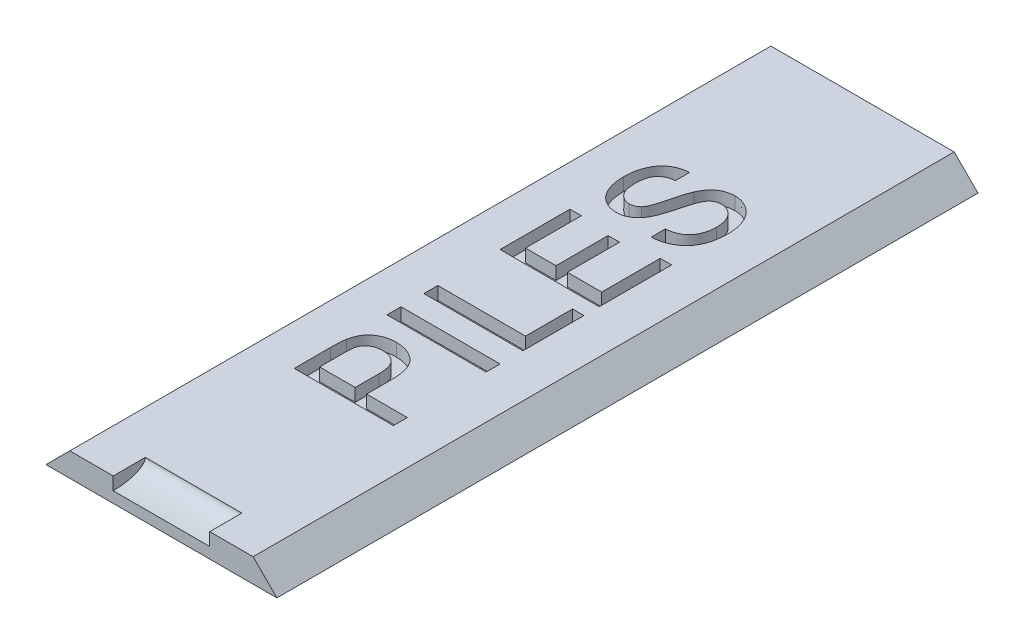
from build123d import *

# Parameters (mm, degrees)
SALIENTE_EXTRUIR1_DEPTH = 54.5
CROQUIS3_RX             = 2.5
CROQUIS3_RY             = 1
CORTAR_EXTRUIR2_DEPTH   = 3.75
CROQUIS4_W              = 7.704956055
CROQUIS4_H              = 1.086596367
CORTAR_EXTRUIR3_DEPTH   = 1


with BuildPart() as part:
    # Croquis1 → Saliente-Extruir1 (new body)
    with BuildSketch(Plane.XY):
        Polygon((0, 0), (1.85, 1.85), (16.1, 1.85), (17.95, 0), align=None)
    extrude(amount=SALIENTE_EXTRUIR1_DEPTH)

    # Croquis3 → Cortar-Extruir2 (cut, symmetric)
    with BuildSketch(Plane(origin=(8.975, 0, 0), x_dir=(0, 0, -1), z_dir=(1, 0, 0))):
        with Locations((-54.5, 1.85)):
            Ellipse(CROQUIS3_RX, CROQUIS3_RY)
    extrude(amount=CORTAR_EXTRUIR2_DEPTH, both=True, mode=Mode.SUBTRACT)

    # Croquis4 → Cortar-Extruir3 (cut)
    # profile 1 of 5: a face of its own
    with BuildSketch(Plane(origin=(0, 1.85, 0), x_dir=(1, 0, 0), z_dir=(0, 1, 0))):
        with BuildLine():
            Line((12.725, -40.224534255), (5.020043945, -40.224534255))
            Line((5.020043945, -40.224534255), (5.020043945, -37.393827243))
            add(Edge.make_bspline(
                [(5.020043945, -37.393827243), (5.020712387, -37.276496719), (5.021967723, -37.056149444), (5.036669327, -36.748437306), (5.054857645, -36.484199896), (5.080753078, -36.324599439), (5.0925866, -36.251666289)],
                knots=[0, 0, 0, 0, 1.22865052, 2.30741144, 3.226532197, 4, 4, 4, 4], degree=3))
            add(Edge.make_bspline(
                [(5.0925866, -36.251666289), (5.109489451, -36.162628237), (5.142281832, -35.989889933), (5.225268231, -35.746863828), (5.3219894, -35.523294036), (5.446633088, -35.323421094), (5.592155323, -35.141713322), (5.766803739, -34.981429606), (5.966372349, -34.839324371), (6.190790323, -34.718498618), (6.432258289, -34.617927706), (6.689506797, -34.547487935), (6.958064607, -34.50237101), (7.141603281, -34.497622162), (7.234910119, -34.495207958)],
                knots=[0, 0, 0, 0, 1.070963964, 2.077723998, 3.031409109, 3.947034396, 4.855896512, 5.777672756, 6.742175787, 7.747333477, 8.787332885, 9.830036646, 10.896840568, 12, 12, 12, 12], degree=3))
            add(Edge.make_bspline(
                [(7.234910119, -34.495207958), (7.314743409, -34.496909349), (7.471819781, -34.500256931), (7.702587646, -34.529002079), (7.924595695, -34.574339399), (8.136324785, -34.641966132), (8.340249896, -34.724641728), (8.532933044, -34.828831715), (8.716985957, -34.950497577), (8.891925848, -35.090080921), (9.054133355, -35.254429358), (9.191947382, -35.452080785), (9.306887372, -35.679773825), (9.403247764, -35.935691127), (9.473527207, -36.222548907), (9.528311414, -36.537980419), (9.557745605, -36.884444343), (9.561856804, -37.125215548), (9.563992388, -37.250285393)],
                knots=[0, 0, 0, 0, 0.928734587, 1.827336177, 2.702165944, 3.561887964, 4.410255795, 5.259404997, 6.106313752, 6.974995773, 7.859929622, 8.783555066, 9.766301868, 10.821656499, 11.958701757, 13.197967894, 14.544469954, 16, 16, 16, 16], degree=3))
            Line((9.563992388, -37.250285393), (9.563992388, -39.137937888))
            Line((9.563992388, -39.137937888), (12.725, -39.137937888))
            Line((12.725, -39.137937888), (12.725, -40.224534255))
        make_face()
        with BuildLine():
            Line((8.674958997, -39.137937888), (8.674958997, -37.279611147))
            add(Edge.make_bspline(
                [(8.674958997, -37.279611147), (8.673714976, -37.205495352), (8.671318486, -37.06271814), (8.654721675, -36.85638616), (8.625668389, -36.667115106), (8.586124634, -36.493820965), (8.533672372, -36.337789043), (8.470964595, -36.197273099), (8.394976718, -36.074374947), (8.307324667, -35.96782338), (8.2090751, -35.876394358), (8.101936262, -35.797094557), (7.98538109, -35.730237373), (7.859182702, -35.676670171), (7.724736421, -35.632399143), (7.579489126, -35.604411928), (7.42579403, -35.58503254), (7.319865427, -35.582895484), (7.265779334, -35.581804324)],
                knots=[0, 0, 0, 0, 1.40421292, 2.705086056, 3.918275699, 5.029558377, 6.068365212, 7.032404237, 7.938575147, 8.797260087, 9.638618655, 10.474993364, 11.317706051, 12.177828306, 13.068718597, 13.993981992, 14.975747128, 16, 16, 16, 16], degree=3))
            add(Edge.make_bspline(
                [(7.265779334, -35.581804324), (7.187347541, -35.584109042), (7.03537411, -35.588574781), (6.816644569, -35.633468235), (6.614700907, -35.704063543), (6.432947694, -35.804195859), (6.275287411, -35.928032887), (6.142785833, -36.069250895), (6.041195642, -36.231560269), (5.998542115, -36.350528828), (5.976989609, -36.410642746)],
                knots=[0, 0, 0, 0, 1.143451971, 2.215610693, 3.244091205, 4.255765529, 5.229231363, 6.159234871, 7.069875225, 8, 8, 8, 8], degree=3))
            add(Edge.make_bspline(
                [(5.976989609, -36.410642746), (5.971593024, -36.432712676), (5.959865872, -36.480672151), (5.946555379, -36.560116645), (5.933951524, -36.652188629), (5.925589453, -36.757336906), (5.917284852, -36.874602552), (5.913456638, -37.004344061), (5.910150152, -37.146856981), (5.909445867, -37.24616686), (5.909077336, -37.298132676)],
                knots=[0, 0, 0, 0, 0.611063981, 1.327884044, 2.165719042, 3.110592661, 4.16481496, 5.328235826, 6.601947678, 8, 8, 8, 8], degree=3))
            Line((5.909077336, -37.298132676), (5.909077336, -39.137937888))
            Line((5.909077336, -39.137937888), (8.674958997, -39.137937888))
        make_face(mode=Mode.SUBTRACT)
    # profile 2 of 5: a face of its own
    with BuildSketch(Plane(origin=(0, 1.85, 0), x_dir=(1, 0, 0), z_dir=(0, 1, 0))):
        with Locations((8.872521973, -32.470187456)):
            Rectangle(CROQUIS4_W, CROQUIS4_H)
    # profile 3 of 5: a face of its own
    with BuildSketch(Plane(origin=(0, 1.85, 0), x_dir=(1, 0, 0), z_dir=(0, 1, 0))):
        Polygon((12.725, -30.148822491), (5.020043945, -30.148822491), (5.020043945, -29.062226124), (11.835966609, -29.062226124), (11.835966609, -25.407311073), (12.725, -25.407311073), align=None)
    # profile 4 of 5: a face of its own
    with BuildSketch(Plane(origin=(0, 1.85, 0), x_dir=(1, 0, 0), z_dir=(0, 1, 0))):
        Polygon((12.725, -24.221933218), (5.020043945, -24.221933218), (5.020043945, -18.788951385), (5.909077336, -18.788951385), (5.909077336, -23.135336851), (8.279833045, -23.135336851), (8.279833045, -19.085295848), (9.168866436, -19.085295848), (9.168866436, -23.135336851), (11.835966609, -23.135336851), (11.835966609, -18.591388409), (12.725, -18.591388409), align=None)
    # profile 5 of 5: a face of its own
    with BuildSketch(Plane(origin=(0, 1.85, 0), x_dir=(1, 0, 0), z_dir=(0, 1, 0))):
        with BuildLine():
            Line((10.057899827, -17.504792042), (10.057899827, -16.418195676))
            add(Edge.make_bspline(
                [(10.057899827, -16.418195676), (10.155466767, -16.406253839), (10.342898111, -16.383312928), (10.608465693, -16.318980185), (10.847115135, -16.236954579), (11.061472654, -16.132559802), (11.251492642, -15.998691026), (11.421841056, -15.834743338), (11.570021369, -15.637253124), (11.698760939, -15.412189393), (11.804702418, -15.164410803), (11.880451865, -14.897911952), (11.925967577, -14.616484744), (11.931780119, -14.423701284), (11.934748097, -14.325262901)],
                knots=[0, 0, 0, 0, 1.125663117, 2.162459464, 3.124651064, 4.013251417, 4.885106576, 5.777454667, 6.711412587, 7.70453926, 8.742726144, 9.79152362, 10.8723159, 12, 12, 12, 12], degree=3))
            add(Edge.make_bspline(
                [(11.934748097, -14.325262901), (11.933083661, -14.238172755), (11.929838332, -14.068363834), (11.892781316, -13.822373021), (11.836622078, -13.591714909), (11.756348797, -13.378942554), (11.657423953, -13.186798246), (11.540433264, -13.018329017), (11.405965658, -12.875927844), (11.253152828, -12.763905309), (11.092873272, -12.675990244), (10.928161901, -12.61147425), (10.759884602, -12.573048001), (10.646660538, -12.568151144), (10.590393785, -12.565717648)],
                knots=[0, 0, 0, 0, 1.267273291, 2.470937522, 3.613914644, 4.718809661, 5.774390768, 6.753382426, 7.696630629, 8.61218657, 9.50073524, 10.352250004, 11.181149856, 12, 12, 12, 12], degree=3))
            add(Edge.make_bspline(
                [(10.590393785, -12.565717648), (10.534687876, -12.568297899), (10.425810757, -12.573340996), (10.266983172, -12.60686922), (10.121062563, -12.669070491), (9.983288138, -12.751340457), (9.857348766, -12.864422046), (9.74329635, -13.009120295), (9.637917046, -13.185172991), (9.580453502, -13.317135911), (9.550101241, -13.386838766)],
                knots=[0, 0, 0, 0, 0.941839432, 1.840823827, 2.725902505, 3.611878027, 4.542122039, 5.568946669, 6.71591688, 8, 8, 8, 8], degree=3))
            add(Edge.make_bspline(
                [(9.550101241, -13.386838766), (9.5389621, -13.413983765), (9.513796756, -13.47530925), (9.480476181, -13.580416511), (9.437422186, -13.705148661), (9.39293408, -13.852451598), (9.346525839, -14.021904032), (9.290873714, -14.212041372), (9.235144294, -14.424538213), (9.174721257, -14.652011958), (9.113861129, -14.881859202), (9.051951432, -15.101002506), (8.992326362, -15.303562802), (8.931970019, -15.489310847), (8.872044918, -15.658562948), (8.813346452, -15.811388271), (8.757275403, -15.948040835), (8.716041031, -16.031501425), (8.696567447, -16.070917007)],
                knots=[0, 0, 0, 0, 0.499206867, 1.127798999, 1.875456396, 2.745236412, 3.745989836, 4.865816661, 6.11691742, 7.484780673, 8.871821359, 10.163659874, 11.360539719, 12.465442435, 13.487424717, 14.416003165, 15.251932479, 16, 16, 16, 16], degree=3))
            add(Edge.make_bspline(
                [(8.696567447, -16.070917007), (8.647548272, -16.1615737), (8.552928507, -16.336564709), (8.384026728, -16.572820324), (8.194749424, -16.770236729), (7.988951227, -16.931452623), (7.768511381, -17.056762282), (7.533463165, -17.142412785), (7.287090189, -17.200195456), (7.117429254, -17.205666227), (7.0311733, -17.208447579)],
                knots=[0, 0, 0, 0, 1.158648043, 2.236492264, 3.255730763, 4.224764102, 5.168065908, 6.094744354, 7.03136427, 8, 8, 8, 8], degree=3))
            add(Edge.make_bspline(
                [(7.0311733, -17.208447579), (6.935653873, -17.204775668), (6.745666425, -17.197472264), (6.466831019, -17.132841849), (6.198259505, -17.029208274), (5.984481011, -16.912324345), (5.82307989, -16.798039314), (5.708463653, -16.702039317), (5.60124325, -16.596122111), (5.501374424, -16.481223492), (5.410177843, -16.356112202), (5.324030469, -16.223744488), (5.249978172, -16.079370256), (5.155728903, -15.876499642), (5.061611366, -15.605108854), (4.979600206, -15.263461267), (4.931305459, -14.903888546), (4.924657476, -14.658795308), (4.921262457, -14.533630102)],
                knots=[0, 0, 0, 0, 1.19987574, 2.38654414, 3.578474407, 4.812047981, 5.438556365, 6.063157668, 6.689933248, 7.332048586, 7.975173567, 8.635638291, 9.315743449, 10.013439258, 11.447896523, 12.918278233, 14.426213869, 16, 16, 16, 16], degree=3))
            add(Edge.make_bspline(
                [(4.921262457, -14.533630102), (4.924347305, -14.396614889), (4.930354098, -14.129819869), (4.981943035, -13.742503285), (5.066587308, -13.380409742), (5.165222652, -13.097295055), (5.263579373, -12.887111418), (5.342821577, -12.738956004), (5.432132479, -12.60096616), (5.526695955, -12.470509832), (5.632668866, -12.352241331), (5.744492627, -12.241306484), (5.864266278, -12.139459095), (6.035764086, -12.018799259), (6.263364726, -11.888487334), (6.558463046, -11.776840777), (6.869463055, -11.699268974), (7.084221677, -11.684288561), (7.193236679, -11.676684257)],
                knots=[0, 0, 0, 0, 1.607284738, 3.12969308, 4.575034728, 5.965153243, 6.637705521, 7.296846459, 7.934914134, 8.565222986, 9.185417795, 9.795898322, 10.412763716, 11.027557596, 12.254905276, 13.478103208, 14.719843788, 16, 16, 16, 16], degree=3))
            Line((7.193236679, -11.676684257), (7.193236679, -12.763280624))
            add(Edge.make_bspline(
                [(7.193236679, -12.763280624), (7.138064783, -12.770185282), (7.030109735, -12.783695652), (6.873821894, -12.817202069), (6.72869359, -12.864211777), (6.593257611, -12.919139225), (6.468947695, -12.98640729), (6.353560223, -13.063156352), (6.250608444, -13.153511126), (6.156345578, -13.252883643), (6.074285814, -13.3650639), (6.003224078, -13.489419056), (5.942527059, -13.625737046), (5.895723995, -13.775269719), (5.856860958, -13.936037713), (5.828963267, -14.109884809), (5.814511774, -14.296204947), (5.81172591, -14.424536852), (5.810295848, -14.490413201)],
                knots=[0, 0, 0, 0, 1.074143617, 2.101780708, 3.08272149, 4.018756036, 4.921684117, 5.809545323, 6.690533959, 7.562671613, 8.451478506, 9.368903006, 10.325822098, 11.328733099, 12.392103336, 13.519840867, 14.726865076, 16, 16, 16, 16], degree=3))
            add(Edge.make_bspline(
                [(5.810295848, -14.490413201), (5.810805779, -14.558889318), (5.811792879, -14.69144224), (5.830088679, -14.883026735), (5.854790021, -15.060729755), (5.892573782, -15.22352156), (5.937579534, -15.373151456), (5.996642006, -15.507246934), (6.064507996, -15.627974619), (6.143666556, -15.733093014), (6.230582437, -15.824236326), (6.322394433, -15.903386301), (6.417302962, -15.971861059), (6.518216437, -16.026385083), (6.622352467, -16.07024701), (6.731651444, -16.098625045), (6.844193619, -16.118694025), (6.920979707, -16.120784273), (6.960174106, -16.121851212)],
                knots=[0, 0, 0, 0, 1.463767833, 2.83349453, 4.11258735, 5.297695043, 6.404355811, 7.448943226, 8.424740201, 9.359993028, 10.255029373, 11.113120303, 11.949635862, 12.752249867, 13.561398762, 14.359474769, 15.162616536, 16, 16, 16, 16], degree=3))
            add(Edge.make_bspline(
                [(6.960174106, -16.121851212), (7.026464161, -16.119043191), (7.155127046, -16.113593082), (7.337918221, -16.057939496), (7.504544221, -15.972343892), (7.595204576, -15.888018583), (7.640840296, -15.845571738)],
                knots=[0, 0, 0, 0, 1.050964922, 2.039826012, 3.013306874, 4, 4, 4, 4], degree=3))
            add(Edge.make_bspline(
                [(7.640840296, -15.845571738), (7.663646844, -15.818813699), (7.714082119, -15.759639949), (7.780827302, -15.649538065), (7.848264787, -15.513028052), (7.915302942, -15.349197802), (7.982755179, -15.158329063), (8.052207121, -14.940730279), (8.121179007, -14.695570126), (8.187673786, -14.430330526), (8.254323711, -14.162343268), (8.321106588, -13.907779197), (8.383170352, -13.673532462), (8.447842879, -13.461892637), (8.504557763, -13.269359478), (8.564443118, -13.099753636), (8.618787739, -12.950027085), (8.657146834, -12.85833554), (8.674958997, -12.815758289)],
                knots=[0, 0, 0, 0, 0.523895241, 1.15856198, 1.91379747, 2.794786646, 3.797548623, 4.933673981, 6.202125154, 7.596592219, 9.013381566, 10.322253347, 11.523322902, 12.62839848, 13.623936171, 14.517279059, 15.31149399, 16, 16, 16, 16], degree=3))
            add(Edge.make_bspline(
                [(8.674958997, -12.815758289), (8.70048893, -12.760350788), (8.750599912, -12.651595149), (8.836371155, -12.497682673), (8.924799262, -12.353226972), (9.021559355, -12.222615033), (9.119958568, -12.100616482), (9.225448936, -11.991447404), (9.334641802, -11.891389628), (9.451646214, -11.805386569), (9.571517617, -11.728131634), (9.695987822, -11.660536912), (9.825774012, -11.606108839), (9.959315635, -11.558372625), (10.098097012, -11.524036455), (10.240716642, -11.497110012), (10.387844802, -11.48140426), (10.487459889, -11.479888853), (10.53791612, -11.479121282)],
                knots=[0, 0, 0, 0, 1.198939608, 2.35331753, 3.461943082, 4.526118786, 5.546665844, 6.541063461, 7.507917594, 8.45466906, 9.391808034, 10.310478591, 11.234866782, 12.156150758, 13.095742909, 14.042062018, 15.008281039, 16, 16, 16, 16], degree=3))
            add(Edge.make_bspline(
                [(10.53791612, -11.479121282), (10.638596849, -11.483205914), (10.838984219, -11.491335661), (11.133916171, -11.559275544), (11.419115014, -11.668287416), (11.645375206, -11.794458088), (11.818453118, -11.914200319), (11.942863909, -12.014756596), (12.057897838, -12.126276557), (12.16716288, -12.246004315), (12.268426735, -12.374872704), (12.361731648, -12.513965595), (12.448019806, -12.661822111), (12.553284802, -12.872928165), (12.662598052, -13.153646574), (12.757411927, -13.510126704), (12.813593698, -13.887186582), (12.820337953, -14.145515819), (12.823781488, -14.277415618)],
                knots=[0, 0, 0, 0, 1.196987384, 2.382393894, 3.582009067, 4.820735309, 5.454243406, 6.085350439, 6.72189866, 7.359035515, 8.013098289, 8.67027723, 9.350744424, 10.048966745, 11.475869723, 12.9268444, 14.430883741, 16, 16, 16, 16], degree=3))
            add(Edge.make_bspline(
                [(12.823781488, -14.277415618), (12.823022136, -14.361297771), (12.821534674, -14.525610926), (12.806051111, -14.767244875), (12.778905887, -14.998208291), (12.7468539, -15.219794305), (12.699428866, -15.429650226), (12.644513832, -15.629965086), (12.577812497, -15.819423697), (12.50288152, -15.999513111), (12.414962582, -16.168253963), (12.320486258, -16.329331437), (12.212973268, -16.47919168), (12.096550188, -16.620569339), (11.970580794, -16.753668633), (11.832263139, -16.875308412), (11.685172011, -16.988800506), (11.528152173, -17.091714413), (11.363198807, -17.183623423), (11.193125991, -17.266354822), (11.017040861, -17.335592756), (10.835353544, -17.392649916), (10.648889852, -17.439355456), (10.456407432, -17.472657885), (10.259113897, -17.496833373), (10.125367352, -17.502123483), (10.057899827, -17.504792042)],
                knots=[0, 0, 0, 0, 1.25996057, 2.468082768, 3.634780732, 4.752960275, 5.829306256, 6.864378612, 7.871400872, 8.844610325, 9.791691919, 10.727448286, 11.647433253, 12.558807848, 13.47716826, 14.396893492, 15.322832279, 16.265995594, 17.214085728, 18.157755542, 19.104963261, 20.053336853, 21.016800397, 21.990101907, 22.986120736, 24, 24, 24, 24], degree=3))
        make_face()
    extrude(amount=-CORTAR_EXTRUIR3_DEPTH, mode=Mode.SUBTRACT)


solid = part.part
